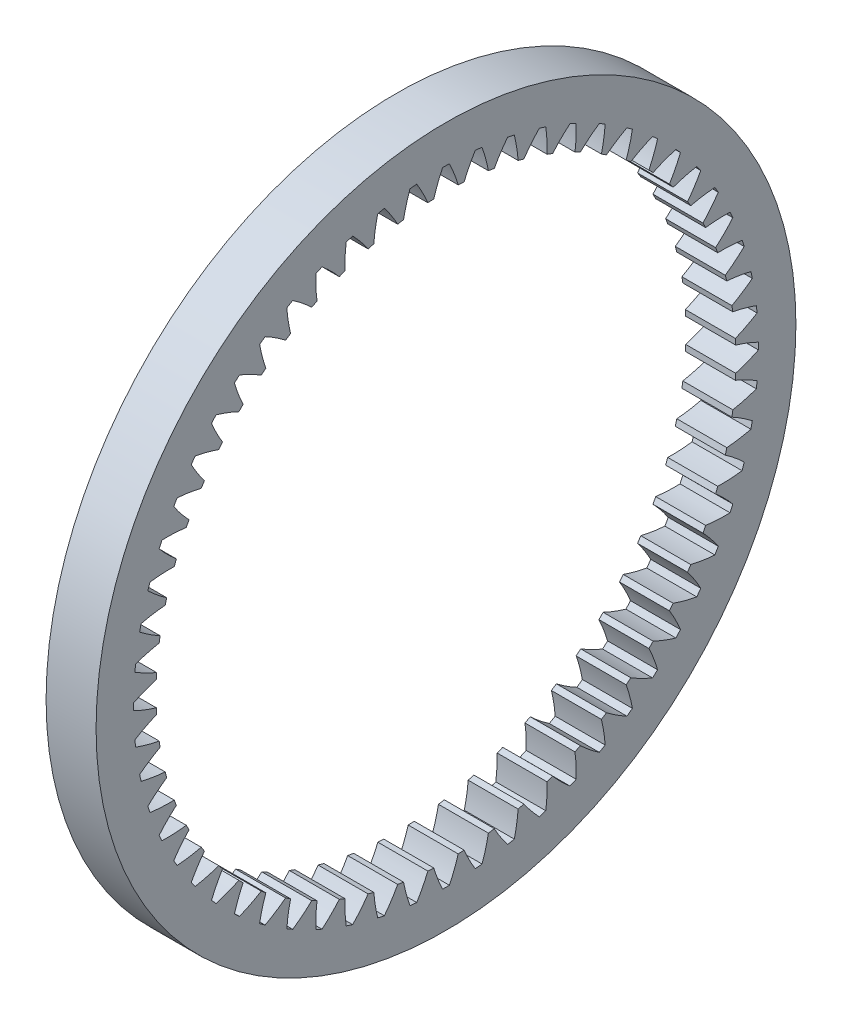
from build123d import *

# Parameters (mm, degrees)
BASPROSKE_W     = 5
BASPROSKE_H     = 6
TOOTHCUT_DEPTH  = 50.749371855
TEETHCUTS_COUNT = 60
TEETHCUTS_ANGLE = 354


with BuildPart() as part:
    # BasProSke → Base-Revolve (revolve)
    with BuildSketch(Plane(origin=(0, 0, 0), x_dir=(1, 0, 0), z_dir=(0, 1, 0)), mode=Mode.PRIVATE) as base_revolve_sk:
        with Locations((2.5, 32)):
            Rectangle(BASPROSKE_W, BASPROSKE_H)
    revolve(base_revolve_sk.sketch.rotate(Axis((-10, 0, 0), (1, 0, 0)), 180), axis=Axis((-10, 0, 0), (1, 0, 0)))

    # TooCutSke → ToothCut (cut, through all)
    with BuildSketch(Plane(origin=(0, 0, 0), x_dir=(0, 0, -1), z_dir=(1, 0, 0))):
        with BuildLine():
            ThreePointArc((1.227357706, 28.948593027), (0.830805794, 30.117149174), (0.339543276, 31.24915537))
            ThreePointArc((0.339543276, 31.24915537), (0, 31.251), (-0.339543276, 31.24915537))
            ThreePointArc((-0.339543276, 31.24915537), (-0.830805794, 30.117149174), (-1.227357706, 28.948593027))
            ThreePointArc((-1.227357706, 28.948593027), (0, 28.9746), (1.227357706, 28.948593027))
        make_face()
    toothcut = extrude(amount=TOOTHCUT_DEPTH, mode=Mode.SUBTRACT)

    # TeethCuts: ToothCut ×60 about axis
    teethcuts_axis = Axis((-10, 0, 0), (1, 0, 0))
    for i in range(1, TEETHCUTS_COUNT):
        add(toothcut.rotate(teethcuts_axis, i * TEETHCUTS_ANGLE / (TEETHCUTS_COUNT - 1)), mode=Mode.SUBTRACT)


solid = part.part
